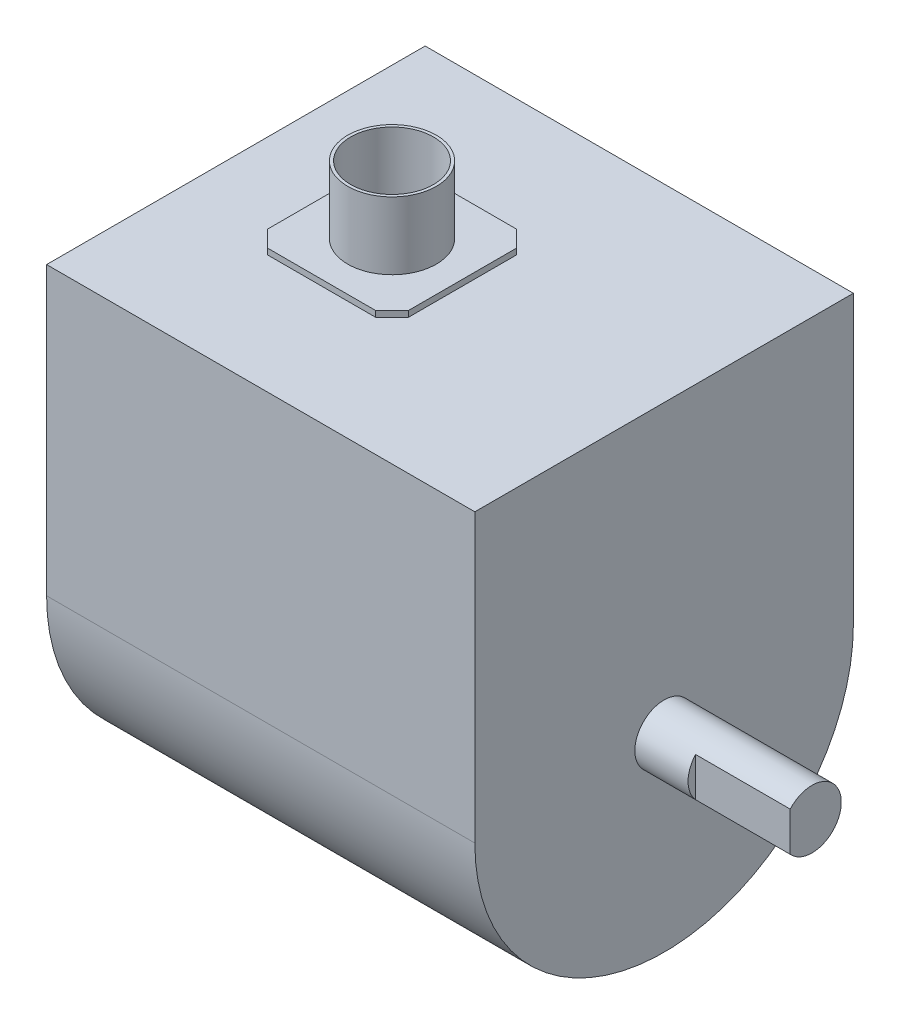
from build123d import *

# Parameters (mm, degrees)
BOSS_EXTRUDE1_DEPTH     = 72.4
BOSS_EXTRUDE3_DEPTH     = 1
SKETCH3_4_R             = 7.493
BOSS_EXTRUDE4_DEPTH     = 12.4
SKETCH6_R               = 6.993
CUT_EXTRUDE1_DEPTH      = 12.4
SKETCH2_3_R             = 4.953
BOSS_EXTRUDE5_DEPTH     = 25
BOSS_EXTRUDE6_START     = 25
SKETCH7_R               = 4.953
BOSS_EXTRUDE6_DEPTH     = 25
CUT_EXTRUDE2_DEPTH      = 120.245838502
CUT_EXTRUDE2_DEPTH_BACK = 120.245838502
SKETCH8_W               = 16
SKETCH8_H               = 1.27


with BuildPart() as part:
    # Sketch2 → Boss-Extrude1 (new body)
    with BuildSketch(Plane(origin=(0, 0, 0), x_dir=(0, 0, -1), z_dir=(1, 0, 0))):
        with BuildLine():
            Line((32, -24.25), (32, 24.25))
            Line((32, 24.25), (-32, 24.25))
            Line((-32, 24.25), (-32, -24.25))
            ThreePointArc((-32, -24.25), (0, -56.25), (32, -24.25))
        make_face()
    extrude(amount=-BOSS_EXTRUDE1_DEPTH)

    # Sketch3 → Boss-Extrude3 (add)
    with BuildSketch(Plane(origin=(0, 24.25, 0), x_dir=(1, 0, 0), z_dir=(0, 1, 0))):
        Polygon((-57.9126, -9.1313), (-55.1313, -11.9126), (-36.8687, -11.9126), (-34.0874, -9.1313), (-34.0874, 9.1313), (-36.8687, 11.9126), (-55.1313, 11.9126), (-57.9126, 9.1313), align=None)
    extrude(amount=BOSS_EXTRUDE3_DEPTH)

    # Sketch3<4> → Boss-Extrude4 (add)
    with BuildSketch(Plane(origin=(0, 24.25, 0), x_dir=(1, 0, 0), z_dir=(0, 1, 0))):
        with Locations((-46, 0)):
            Circle(SKETCH3_4_R)
    extrude(amount=BOSS_EXTRUDE4_DEPTH)

    # Sketch6 → Cut-Extrude1 (cut)
    with BuildSketch(Plane(origin=(0, 36.65, 0), x_dir=(1, 0, 0), z_dir=(0, 1, 0))):
        with Locations((-46, 0)):
            Circle(SKETCH6_R)
    extrude(amount=-CUT_EXTRUDE1_DEPTH, mode=Mode.SUBTRACT)

    # Sketch2<3> → Boss-Extrude5 (add)
    with BuildSketch(Plane(origin=(0, 0, 0), x_dir=(0, 0, -1), z_dir=(1, 0, 0))):
        with Locations((0, -24.25)):
            Circle(SKETCH2_3_R)
    extrude(amount=BOSS_EXTRUDE5_DEPTH)

    # Sketch7 → Boss-Extrude6 (add)
    with BuildSketch(Plane.ZY.offset(72.4).offset(BOSS_EXTRUDE6_START)):
        with Locations((0, -24.25)):
            Circle(SKETCH7_R)
    extrude(amount=-BOSS_EXTRUDE6_DEPTH)

    # Sketch8 → Cut-Extrude2 (cut, two sides: drawn at the far end of the back side and taken through both)
    with BuildSketch(Plane(origin=(0, -24.25, 0), x_dir=(1, 0, 0), z_dir=(0, 1, 0)).offset(-CUT_EXTRUDE2_DEPTH_BACK)):
        with Locations((17, -4.318)):
            Rectangle(SKETCH8_W, SKETCH8_H)
        with Locations((-89.4, -4.318)):
            Rectangle(SKETCH8_W, SKETCH8_H)
    extrude(amount=CUT_EXTRUDE2_DEPTH + CUT_EXTRUDE2_DEPTH_BACK, mode=Mode.SUBTRACT)


solid = part.part
